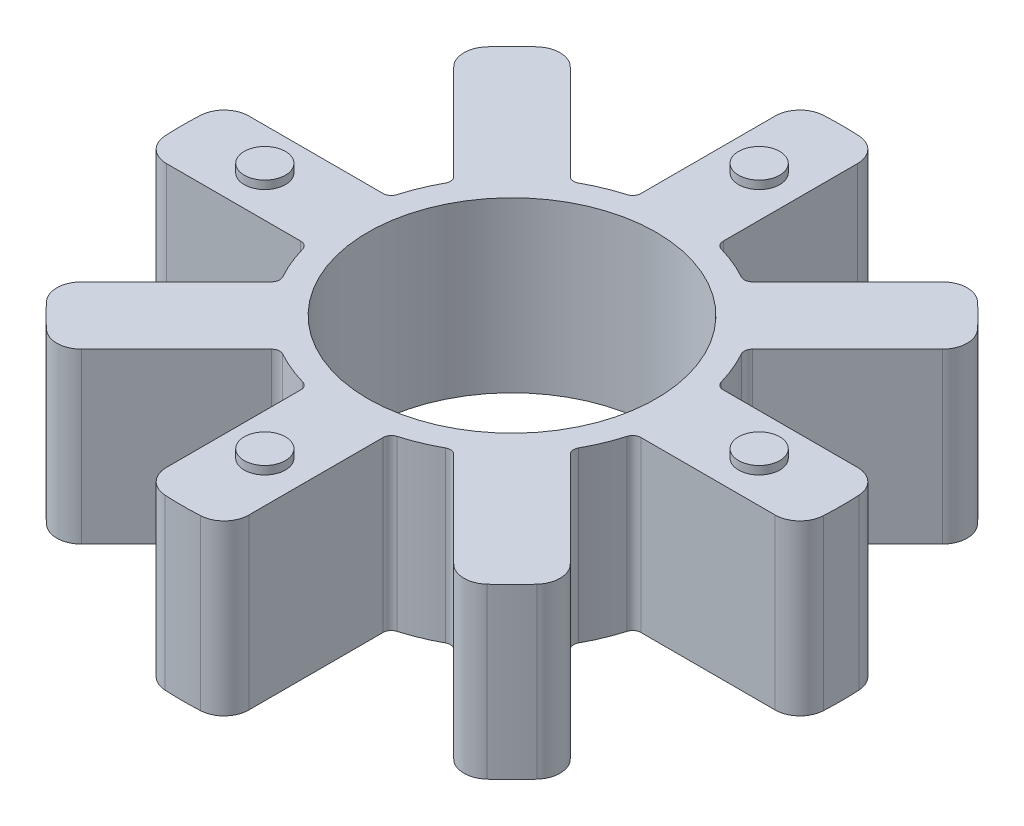
from build123d import *

# Parameters (mm, degrees)
SKETCH1_R           = 17.5
BOSS_EXTRUDE1_DEPTH = 20.5
SKETCH2_R           = 2.5
BOSS_EXTRUDE2_DEPTH = 1
SKETCH3_R           = 2.394052793
BOSS_EXTRUDE3_DEPTH = 1


with BuildPart() as part:
    # Sketch1 → Boss-Extrude1 (new body)
    with BuildSketch(Plane(origin=(0, 0, 0), x_dir=(1, 0, 0), z_dir=(0, 1, 0))):
        with BuildLine():
            Line((5, 20.645822822), (5, 36.945906404))
            ThreePointArc((5, 36.945906404), (4.177898814, 39.00909732), (2.162162162, 39.941520437))
            ThreePointArc((2.162162162, 39.941520437), (0, 40), (-2.162162162, 39.941520437))
            ThreePointArc((-2.162162162, 39.941520437), (-4.177898814, 39.00909732), (-5, 36.945906404))
            Line((-5, 36.945906404), (-5, 20.645822822))
            ThreePointArc((-5, 20.645822822), (-5.200290751, 20.04543535), (-5.720930233, 19.685551993))
            ThreePointArc((-5.720930233, 19.685551993), (-7.845010363, 18.939530416), (-9.874478744, 17.965095868))
            ThreePointArc((-9.874478744, 17.965095868), (-10.497102414, 17.851424122), (-11.063267415, 18.134335227))
            Line((-11.063267415, 18.134335227), (-22.589167049, 29.660234861))
            ThreePointArc((-22.589167049, 29.660234861), (-24.629376661, 30.537817825), (-26.714040425, 29.771799478))
            ThreePointArc((-26.714040425, 29.771799478), (-28.284271247, 28.284271247), (-29.771799478, 26.714040425))
            ThreePointArc((-29.771799478, 26.714040425), (-30.537817825, 24.629376661), (-29.660234861, 22.589167049))
            Line((-29.660234861, 22.589167049), (-18.134335227, 11.063267415))
            ThreePointArc((-18.134335227, 11.063267415), (-17.851424122, 10.497102414), (-17.965095868, 9.874478744))
            ThreePointArc((-17.965095868, 9.874478744), (-18.939530416, 7.845010363), (-19.685551993, 5.720930233))
            ThreePointArc((-19.685551993, 5.720930233), (-20.04543535, 5.200290751), (-20.645822822, 5))
            Line((-20.645822822, 5), (-36.945906404, 5))
            ThreePointArc((-36.945906404, 5), (-39.00909732, 4.177898814), (-39.941520437, 2.162162162))
            ThreePointArc((-39.941520437, 2.162162162), (-40, 0), (-39.941520437, -2.162162162))
            ThreePointArc((-39.941520437, -2.162162162), (-39.00909732, -4.177898814), (-36.945906404, -5))
            Line((-36.945906404, -5), (-20.645822822, -5))
            ThreePointArc((-20.645822822, -5), (-20.04543535, -5.200290751), (-19.685551993, -5.720930233))
            ThreePointArc((-19.685551993, -5.720930233), (-18.939530416, -7.845010363), (-17.965095868, -9.874478744))
            ThreePointArc((-17.965095868, -9.874478744), (-17.851424122, -10.497102414), (-18.134335227, -11.063267415))
            Line((-18.134335227, -11.063267415), (-29.660234861, -22.589167049))
            ThreePointArc((-29.660234861, -22.589167049), (-30.537817825, -24.629376661), (-29.771799478, -26.714040425))
            ThreePointArc((-29.771799478, -26.714040425), (-28.284271247, -28.284271247), (-26.714040425, -29.771799478))
            ThreePointArc((-26.714040425, -29.771799478), (-24.629376661, -30.537817825), (-22.589167049, -29.660234861))
            Line((-22.589167049, -29.660234861), (-11.063267415, -18.134335227))
            ThreePointArc((-11.063267415, -18.134335227), (-10.497102414, -17.851424122), (-9.874478744, -17.965095868))
            ThreePointArc((-9.874478744, -17.965095868), (-7.845010363, -18.939530416), (-5.720930233, -19.685551993))
            ThreePointArc((-5.720930233, -19.685551993), (-5.200290751, -20.04543535), (-5, -20.645822822))
            Line((-5, -20.645822822), (-5, -36.945906404))
            ThreePointArc((-5, -36.945906404), (-4.177898814, -39.00909732), (-2.162162162, -39.941520437))
            ThreePointArc((-2.162162162, -39.941520437), (0, -40), (2.162162162, -39.941520437))
            ThreePointArc((2.162162162, -39.941520437), (4.177898814, -39.00909732), (5, -36.945906404))
            Line((5, -36.945906404), (5, -20.645822822))
            ThreePointArc((5, -20.645822822), (5.200290751, -20.04543535), (5.720930233, -19.685551993))
            ThreePointArc((5.720930233, -19.685551993), (7.845010363, -18.939530416), (9.874478744, -17.965095868))
            ThreePointArc((9.874478744, -17.965095868), (10.497102414, -17.851424122), (11.063267415, -18.134335227))
            Line((11.063267415, -18.134335227), (22.589167049, -29.660234861))
            ThreePointArc((22.589167049, -29.660234861), (24.629376661, -30.537817825), (26.714040425, -29.771799478))
            ThreePointArc((26.714040425, -29.771799478), (28.284271247, -28.284271247), (29.771799478, -26.714040425))
            ThreePointArc((29.771799478, -26.714040425), (30.537817825, -24.629376661), (29.660234861, -22.589167049))
            Line((29.660234861, -22.589167049), (18.134335227, -11.063267415))
            ThreePointArc((18.134335227, -11.063267415), (17.851424122, -10.497102414), (17.965095868, -9.874478744))
            ThreePointArc((17.965095868, -9.874478744), (18.939530416, -7.845010363), (19.685551993, -5.720930233))
            ThreePointArc((19.685551993, -5.720930233), (20.04543535, -5.200290751), (20.645822822, -5))
            Line((20.645822822, -5), (36.945906404, -5))
            ThreePointArc((36.945906404, -5), (39.00909732, -4.177898814), (39.941520437, -2.162162162))
            ThreePointArc((39.941520437, -2.162162162), (40, 0), (39.941520437, 2.162162162))
            ThreePointArc((39.941520437, 2.162162162), (39.00909732, 4.177898814), (36.945906404, 5))
            Line((36.945906404, 5), (20.645822822, 5))
            ThreePointArc((20.645822822, 5), (20.04543535, 5.200290751), (19.685551993, 5.720930233))
            ThreePointArc((19.685551993, 5.720930233), (18.939530416, 7.845010363), (17.965095868, 9.874478744))
            ThreePointArc((17.965095868, 9.874478744), (17.851424122, 10.497102414), (18.134335227, 11.063267415))
            Line((18.134335227, 11.063267415), (29.660234861, 22.589167049))
            ThreePointArc((29.660234861, 22.589167049), (30.537817825, 24.629376661), (29.771799478, 26.714040425))
            ThreePointArc((29.771799478, 26.714040425), (28.284271247, 28.284271247), (26.714040425, 29.771799478))
            ThreePointArc((26.714040425, 29.771799478), (24.629376661, 30.537817825), (22.589167049, 29.660234861))
            Line((22.589167049, 29.660234861), (11.063267415, 18.134335227))
            ThreePointArc((11.063267415, 18.134335227), (10.497102414, 17.851424122), (9.874478744, 17.965095868))
            ThreePointArc((9.874478744, 17.965095868), (7.845010363, 18.939530416), (5.720930233, 19.685551993))
            ThreePointArc((5.720930233, 19.685551993), (5.200290751, 20.04543535), (5, 20.645822822))
        make_face()
        with Locations(Location((0, 0, 0), (0, 0, 270))):
            Circle(SKETCH1_R, mode=Mode.SUBTRACT)
    extrude(amount=BOSS_EXTRUDE1_DEPTH)

    # Sketch2 → Boss-Extrude2 (add)
    with BuildSketch(Plane(origin=(0, 20.5, 0), x_dir=(1, 0, 0), z_dir=(0, 1, 0))):
        with Locations(Location((0, 30, 0), (0, 0, 270))):
            Circle(SKETCH2_R)
        with Locations(Location((30, 0, 0), (0, 0, 270))):
            Circle(SKETCH2_R)
        with Locations(Location((0, -30, 0), (0, 0, 270))):
            Circle(SKETCH2_R)
        with Locations(Location((-30, 0, 0), (0, 0, 270))):
            Circle(SKETCH2_R)
    extrude(amount=BOSS_EXTRUDE2_DEPTH)

    # Sketch3 → Boss-Extrude3 (add)
    with BuildSketch(Plane.XZ):
        with Locations(Location((-21.213203436, 21.213203436, 0), (0, 0, 90))):
            Circle(SKETCH3_R)
        with Locations(Location((21.213203436, 21.213203436, 0), (0, 0, 90))):
            Circle(SKETCH3_R)
        with Locations(Location((21.213203436, -21.213203436, 0), (0, 0, 90))):
            Circle(SKETCH3_R)
        with Locations(Location((-21.213203436, -21.213203436, 0), (0, 0, 90))):
            Circle(SKETCH3_R)
    extrude(amount=BOSS_EXTRUDE3_DEPTH)


solid = part.part
